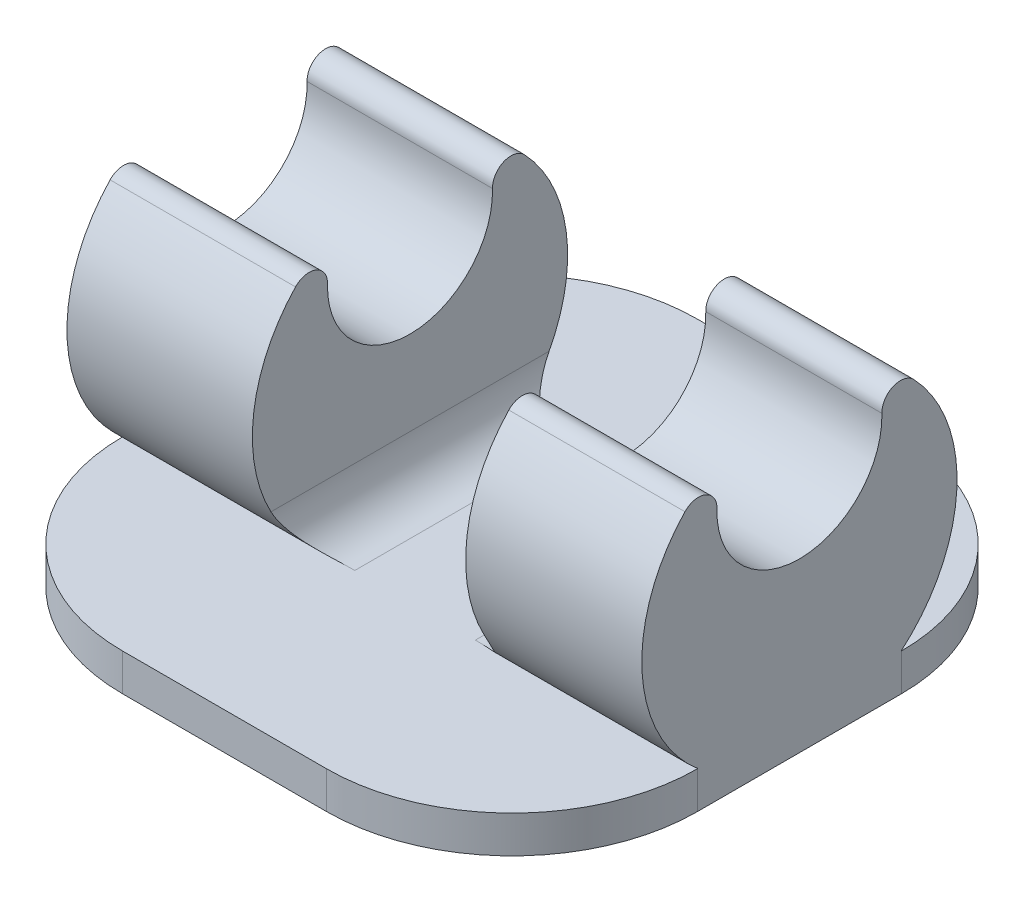
from build123d import *

# Parameters (mm, degrees)
BOSS_EXTRUDE1_DEPTH = 2
SKETCH2_R           = 8.5
BOSS_EXTRUDE3_DEPTH = 31
SKETCH3_R           = 4.45
CUT_EXTRUDE1_DEPTH  = 33
FILLET1_R           = 1
SKETCH4_W           = 11.502222151
SKETCH4_H           = 31
CUT_EXTRUDE2_DEPTH  = 20
FILLET2_R           = 10
FILLET3_R           = 2.5


with BuildPart() as part:
    # Sketch1 → Boss-Extrude1 (new body)
    with BuildSketch(Plane(origin=(0, 0, 0), x_dir=(1, 0, 0), z_dir=(0, 1, 0))):
        Polygon((0, 15.5), (15.5, 15.5), (15.5, -15.5), (-15.5, -15.5), (-15.5, 15.5), align=None)
    extrude(amount=BOSS_EXTRUDE1_DEPTH)

    # Sketch2 → Boss-Extrude3 (add)
    with BuildSketch(Plane(origin=(15.5, 0, 0), x_dir=(0, 0, -1), z_dir=(1, 0, 0))):
        with Locations((0, 8.5)):
            Circle(SKETCH2_R)
    extrude(amount=-BOSS_EXTRUDE3_DEPTH)

    # Sketch3 → Cut-Extrude1 (cut)
    with BuildSketch(Plane.ZY.offset(15.5)):
        with Locations((0, 13.5)):
            Circle(SKETCH3_R)
    extrude(amount=-CUT_EXTRUDE1_DEPTH, mode=Mode.SUBTRACT)

    # Fillet1
    fillet1_edges = [part.edges().sort_by_distance(p)[0] for p in [
        (0, 16.24475, -3.502691456),
        (0, 16.24475, 3.502691456),
    ]]
    fillet(fillet1_edges, radius=FILLET1_R)

    # Sketch4 → Cut-Extrude2 (cut)
    with BuildSketch(Plane(origin=(0, 2, 0), x_dir=(1, 0, 0), z_dir=(0, 1, 0))):
        with Locations((0.251111076, 0)):
            Rectangle(SKETCH4_W, SKETCH4_H)
    extrude(amount=CUT_EXTRUDE2_DEPTH, mode=Mode.SUBTRACT)

    # Fillet2
    fillet2_edges = [part.edges().sort_by_distance(p)[0] for p in [
        (15.5, 1, -15.5),
        (15.5, 1, 15.5),
        (-15.5, 1, 15.5),
        (-15.5, 1, -15.5),
    ]]
    fillet(fillet2_edges, radius=FILLET2_R)

    # Fillet3
    fillet3_edges = [part.edges().sort_by_distance(p)[0] for p in [
        (-5.5, 2, 0),
        (6.002222151, 2, 0),
    ]]
    fillet(fillet3_edges, radius=FILLET3_R)


solid = part.part
